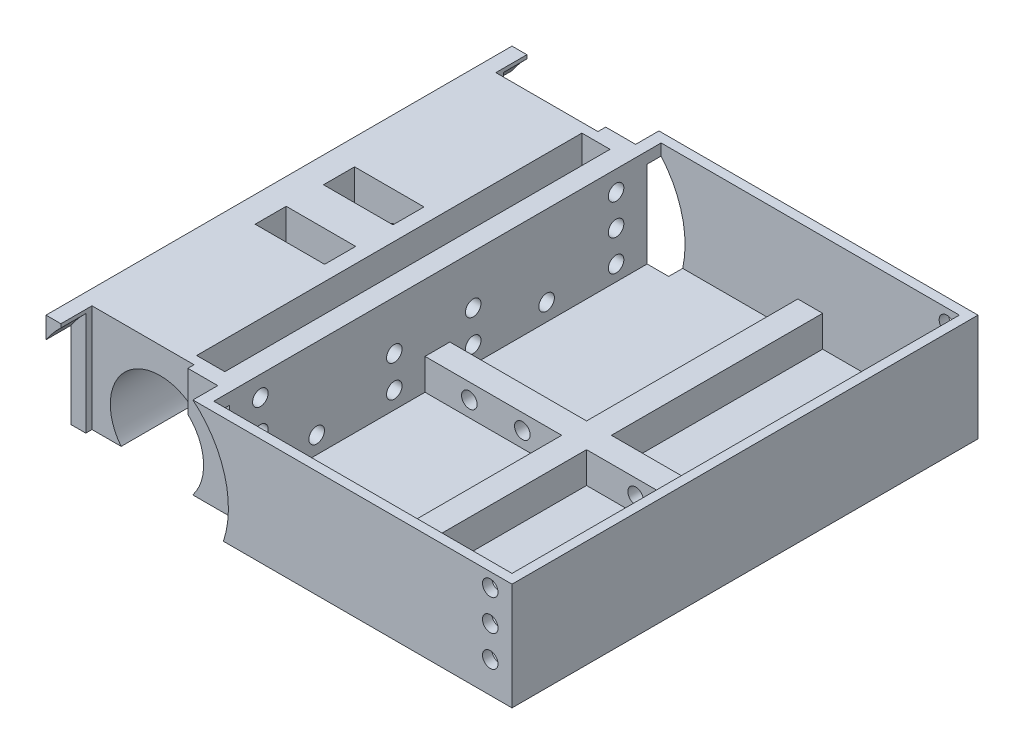
from build123d import *

# Parameters (mm, degrees)
CUBE_W                    = 150
CUBE_H                    = 150
BOSS_EXTRU_1_DEPTH        = 34.5
PAVE_W                    = 96
PAVE_H                    = 144
ENL_V_MAT_EXTRU_1_DEPTH   = 31.5
VIS1_R                    = 2.5
ENL_V_MAT_EXTRU_2_DEPTH   = 5
ENL_V_START               = -5
VIS2_R                    = 2.5
ENL_V_MAT_EXTRU_3_DEPTH   = 5
PAVE_PROCHE_MOTEUR_W      = 12.5
PAVE_PROCHE_MOTEUR_H      = 124
ENL_V_MAT_EXTRU_4_DEPTH   = 31.5
PAVE_ROUE_LIBRE_W         = 32.86
PAVE_ROUE_LIBRE_H         = 15.696676457
PAVE_ROUE_LIBRE_H_2       = 18.419496328
ENL_V_MAT_EXTRU_5_DEPTH   = 36
CABLES_W                  = 22.36
CABLES_H                  = 10
ENL_V_MAT_EXTRU_6_DEPTH   = 36
ROUE_EXT_R                = 32
ENL_V_MAT_EXTRU_7_DEPTH   = 8
ROUE_INTER_R              = 16.02
ENL_V_MAT_EXTRU_8_DEPTH   = 69
ENL_V_START_2             = -7.5
ROUE_EXT2_R               = 32
ENL_V_MAT_EXTRU_9_DEPTH   = 7.5
ENL_V_START_3             = -69
ROUE_INTER2_R             = 16.02
ENL_V_MAT_EXTRU_10_DEPTH  = 69
VIS_MOTEUR_POUR_SUPPORT_R = 2.5
ENL_V_MAT_EXTRU_11_DEPTH  = 10
BOSS_EXTRU_2_DEPTH        = 10
ESQUISSE2_R               = 2.5
ENL_V_MAT_EXTRU_12_DEPTH  = 10
ESQUISSE3_W               = 3.439870431
ESQUISSE3_H               = 124
BOSS_EXTRU_3_DEPTH        = 31
ESQUISSE5_W               = 3.439870431
ESQUISSE5_H               = 124
BOSS_EXTRU_4_DEPTH        = 0.5
ESQUISSE6_R               = 2.5
ENL_V_MAT_EXTRU_13_DEPTH  = 10
ESQUISSE7_R               = 2.5
ENL_V_MAT_EXTRU_14_DEPTH  = 10
ESQUISSE8_R               = 2.5
ENL_V_MAT_EXTRU_15_DEPTH  = 10


with BuildPart() as part:
    # Cube → Boss.-Extru.1 (new body)
    with BuildSketch(Plane(origin=(0, 0, 0), x_dir=(1, 0, 0), z_dir=(0, 1, 0))):
        with Locations((-34.210526316, -11.513157895)):
            Rectangle(CUBE_W, CUBE_H)
    extrude(amount=BOSS_EXTRU_1_DEPTH)

    # Pave → Enlèv. mat.-Extru.1 (cut)
    with BuildSketch(Plane(origin=(0, 34.5, 0), x_dir=(1, 0, 0), z_dir=(0, 1, 0))):
        with Locations((-10.210526316, -11.513157895)):
            Rectangle(PAVE_W, PAVE_H)
    extrude(amount=-ENL_V_MAT_EXTRU_1_DEPTH, mode=Mode.SUBTRACT)

    # Vis1 → Enlèv. mat.-Extru.2 (cut)
    with BuildSketch(Plane.XY.offset(86.513157895)):
        with Locations((33.789473684, 10)):
            Circle(VIS1_R)
        with Locations((33.789473684, 20)):
            Circle(VIS1_R)
        with Locations((33.789473684, 30)):
            Circle(VIS1_R)
    extrude(amount=-ENL_V_MAT_EXTRU_2_DEPTH, mode=Mode.SUBTRACT)

    # Vis2 → Enlèv. mat.-Extru.3 (cut)
    with BuildSketch(Plane(origin=(0, 0, -63.486842105), x_dir=(-1, 0, 0), z_dir=(0, 0, -1)).offset(ENL_V_START)):
        with Locations(Location((-33.789473684, 10, 0), (0, 0, 180))):
            Circle(VIS2_R)
        with Locations(Location((-33.789473684, 20, 0), (0, 0, 180))):
            Circle(VIS2_R)
        with Locations(Location((-33.789473684, 30, 0), (0, 0, 180))):
            Circle(VIS2_R)
    extrude(amount=ENL_V_MAT_EXTRU_3_DEPTH, mode=Mode.SUBTRACT)

    # Pave proche moteur → Enlèv. mat.-Extru.4 (cut)
    with BuildSketch(Plane(origin=(0, 34.5, 0), x_dir=(1, 0, 0), z_dir=(0, 1, 0))):
        with Locations((-67.460526316, -11.513157895)):
            Rectangle(PAVE_PROCHE_MOTEUR_W, PAVE_PROCHE_MOTEUR_H)
    extrude(amount=-ENL_V_MAT_EXTRU_4_DEPTH, mode=Mode.SUBTRACT)

    # Pave Roue libre → Enlèv. mat.-Extru.5 (cut)
    with BuildSketch(Plane(origin=(0, 34.5, 0), x_dir=(1, 0, 0), z_dir=(0, 1, 0))):
        with Locations((-87.980526316, 61.335180334)):
            Rectangle(PAVE_ROUE_LIBRE_W, PAVE_ROUE_LIBRE_H)
        with Locations((-87.980526316, -85.722906059)):
            Rectangle(PAVE_ROUE_LIBRE_W, PAVE_ROUE_LIBRE_H_2)
    extrude(amount=-ENL_V_MAT_EXTRU_5_DEPTH, mode=Mode.SUBTRACT)

    # Cables → Enlèv. mat.-Extru.6 (cut)
    with BuildSketch(Plane(origin=(0, 34.5, 0), x_dir=(1, 0, 0), z_dir=(0, 1, 0))):
        with Locations((-89.710526316, -0.513157895)):
            Rectangle(CABLES_W, CABLES_H)
        with Locations((-89.710526316, -22.513157895)):
            Rectangle(CABLES_W, CABLES_H)
    extrude(amount=-ENL_V_MAT_EXTRU_6_DEPTH, mode=Mode.SUBTRACT)

    # Roue ext → Enlèv. mat.-Extru.7 (cut)
    with BuildSketch(Plane.XY.offset(86.513157895)):
        with Locations((-82.5, 10)):
            Circle(ROUE_EXT_R)
    extrude(amount=-ENL_V_MAT_EXTRU_7_DEPTH, mode=Mode.SUBTRACT)

    # Roue inter → Enlèv. mat.-Extru.8 (cut)
    with BuildSketch(Plane.XY.offset(86.513157895)):
        with Locations((-82.5, 10)):
            Circle(ROUE_INTER_R)
    extrude(amount=-ENL_V_MAT_EXTRU_8_DEPTH, mode=Mode.SUBTRACT)

    # Roue ext2 → Enlèv. mat.-Extru.9 (cut)
    with BuildSketch(Plane(origin=(0, 0, -63.486842105), x_dir=(-1, 0, 0), z_dir=(0, 0, -1)).offset(ENL_V_START_2)):
        with Locations((82.5, 10)):
            Circle(ROUE_EXT2_R)
    extrude(amount=ENL_V_MAT_EXTRU_9_DEPTH, mode=Mode.SUBTRACT)

    # Roue inter2 → Enlèv. mat.-Extru.10 (cut)
    with BuildSketch(Plane(origin=(0, 0, -63.486842105), x_dir=(-1, 0, 0), z_dir=(0, 0, -1)).offset(ENL_V_START_3)):
        with Locations((82.5, 10)):
            Circle(ROUE_INTER2_R)
    extrude(amount=ENL_V_MAT_EXTRU_10_DEPTH, mode=Mode.SUBTRACT)

    # Vis Moteur pour support → Enlèv. mat.-Extru.11 (cut)
    with BuildSketch(Plane(origin=(-58.210526316, 0, 0), x_dir=(0, 0, -1), z_dir=(1, 0, 0))):
        with Locations((-68.513157895, 8)):
            Circle(VIS_MOTEUR_POUR_SUPPORT_R)
        with Locations((-68.513157895, 18)):
            Circle(VIS_MOTEUR_POUR_SUPPORT_R)
        with Locations((-68.513157895, 28)):
            Circle(VIS_MOTEUR_POUR_SUPPORT_R)
        with Locations((45.986842105, 8)):
            Circle(VIS_MOTEUR_POUR_SUPPORT_R)
        with Locations((45.986842105, 18)):
            Circle(VIS_MOTEUR_POUR_SUPPORT_R)
        with Locations((45.986842105, 28)):
            Circle(VIS_MOTEUR_POUR_SUPPORT_R)
    extrude(amount=-ENL_V_MAT_EXTRU_11_DEPTH, mode=Mode.SUBTRACT)

    # Esquisse1 → Boss.-Extru.2 (add)
    with BuildSketch(Plane(origin=(0, 3, 0), x_dir=(1, 0, 0), z_dir=(0, 1, 0))):
        Polygon((-58.210526316, -15.513157895), (-14.210526316, -15.513157895), (-14.210526316, -83.513157895), (-6.210526316, -83.513157895), (-6.210526316, -15.513157895), (37.789473684, -15.513157895), (37.789473684, -7.513157895), (-6.210526316, -7.513157895), (-6.210526316, 60.486842105), (-14.210526316, 60.486842105), (-14.210526316, -7.513157895), (-58.210526316, -7.513157895), align=None)
    extrude(amount=BOSS_EXTRU_2_DEPTH)

    # Esquisse2 → Enlèv. mat.-Extru.12 (cut)
    with BuildSketch(Plane.XY.offset(15.513157895)):
        with Locations((-43.942882256, 8)):
            Circle(ESQUISSE2_R)
        with Locations((-26.88958752, 8)):
            Circle(ESQUISSE2_R)
        with Locations((9.588466595, 8)):
            Circle(ESQUISSE2_R)
        with Locations((23.56238511, 8)):
            Circle(ESQUISSE2_R)
    extrude(amount=-ENL_V_MAT_EXTRU_12_DEPTH, mode=Mode.SUBTRACT)

    # Esquisse3 → Boss.-Extru.3 (add)
    with BuildSketch(Plane(origin=(0, 3, 0), x_dir=(1, 0, 0), z_dir=(0, 1, 0))):
        with Locations((-62.930461532, -11.513157895)):
            Rectangle(ESQUISSE3_W, ESQUISSE3_H)
    extrude(amount=BOSS_EXTRU_3_DEPTH)

    # Esquisse5 → Boss.-Extru.4 (add)
    with BuildSketch(Plane(origin=(0, 34, 0), x_dir=(1, 0, 0), z_dir=(0, 1, 0))):
        with Locations((-62.930461532, -11.513157895)):
            Rectangle(ESQUISSE5_W, ESQUISSE5_H)
    extrude(amount=BOSS_EXTRU_4_DEPTH)

    # Esquisse6 → Enlèv. mat.-Extru.13 (cut)
    with BuildSketch(Plane(origin=(-58.210526316, 0, 0), x_dir=(0, 0, -1), z_dir=(1, 0, 0))):
        with Locations((-68.513157895, 28)):
            Circle(ESQUISSE6_R)
        with Locations((-68.513157895, 18)):
            Circle(ESQUISSE6_R)
        with Locations((-68.513157895, 8)):
            Circle(ESQUISSE6_R)
        with Locations((45.986842105, 28)):
            Circle(ESQUISSE6_R)
        with Locations((45.986842105, 18)):
            Circle(ESQUISSE6_R)
        with Locations((45.986842105, 8)):
            Circle(ESQUISSE6_R)
    extrude(amount=-ENL_V_MAT_EXTRU_13_DEPTH, mode=Mode.SUBTRACT)

    # Esquisse7 → Enlèv. mat.-Extru.14 (cut)
    with BuildSketch(Plane(origin=(-58.210526316, 0, 0), x_dir=(0, 0, -1), z_dir=(1, 0, 0))):
        with Locations((0, 8.527871685)):
            Circle(ESQUISSE7_R)
        with Locations((0, 18.750861141)):
            Circle(ESQUISSE7_R)
        with Locations((-25.400224022, 8.527871685)):
            Circle(ESQUISSE7_R)
        with Locations((-25.400224022, 18.750861141)):
            Circle(ESQUISSE7_R)
        with Locations((-50.386538843, 8.527871685)):
            Circle(ESQUISSE7_R)
        with Locations((23.629525814, 8.527871685)):
            Circle(ESQUISSE7_R)
    extrude(amount=-ENL_V_MAT_EXTRU_14_DEPTH, mode=Mode.SUBTRACT)

    # Esquisse8 → Enlèv. mat.-Extru.15 (cut)
    with BuildSketch(Plane(origin=(0, 3, 0), x_dir=(1, 0, 0), z_dir=(0, 1, 0))):
        with Locations(Location((19.789473684, -43.513157895, 0), (0, 0, 270))):
            Circle(ESQUISSE8_R)
        with Locations(Location((19.789473684, 20.486842105, 0), (0, 0, 270))):
            Circle(ESQUISSE8_R)
    extrude(amount=-ENL_V_MAT_EXTRU_15_DEPTH, mode=Mode.SUBTRACT)


solid = part.part
